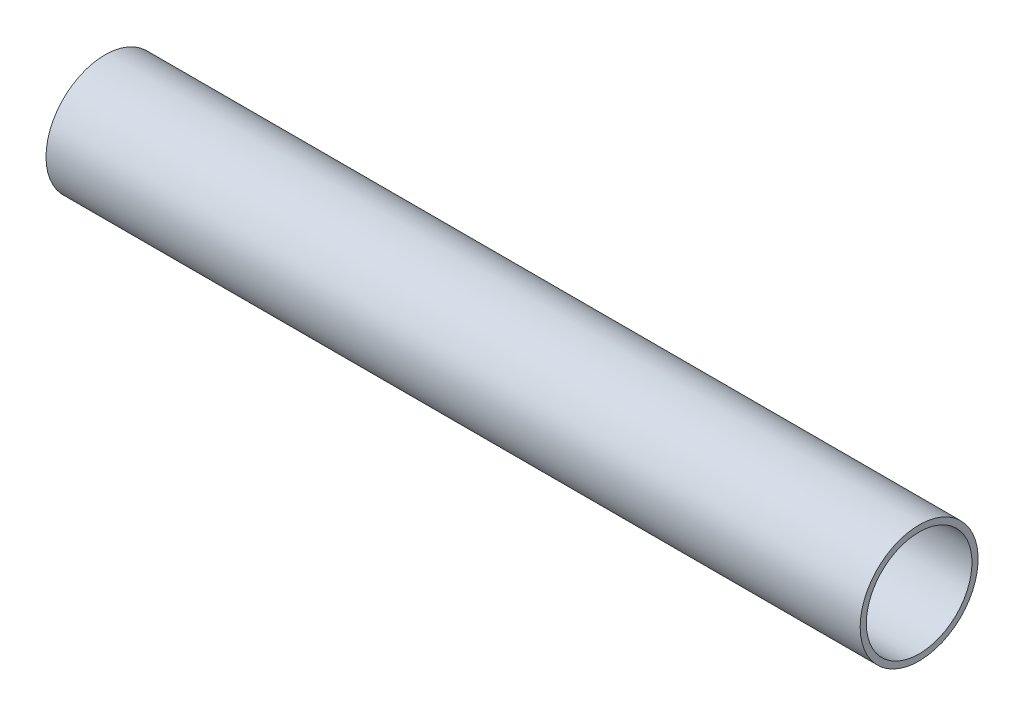
from build123d import *


with BuildPart() as part:
    # Leg_Piston Sketch → Leg_Piston (revolve)
    with BuildSketch(Plane.XY):
        Polygon((1240, 0), (1240, 13.4), (1425, 13.4), (1425, 12), (1242, 12), (1242, 0), align=None)
    revolve(axis=Axis((-3000, 0, 0), (1, 0, 0)))


solid = part.part
